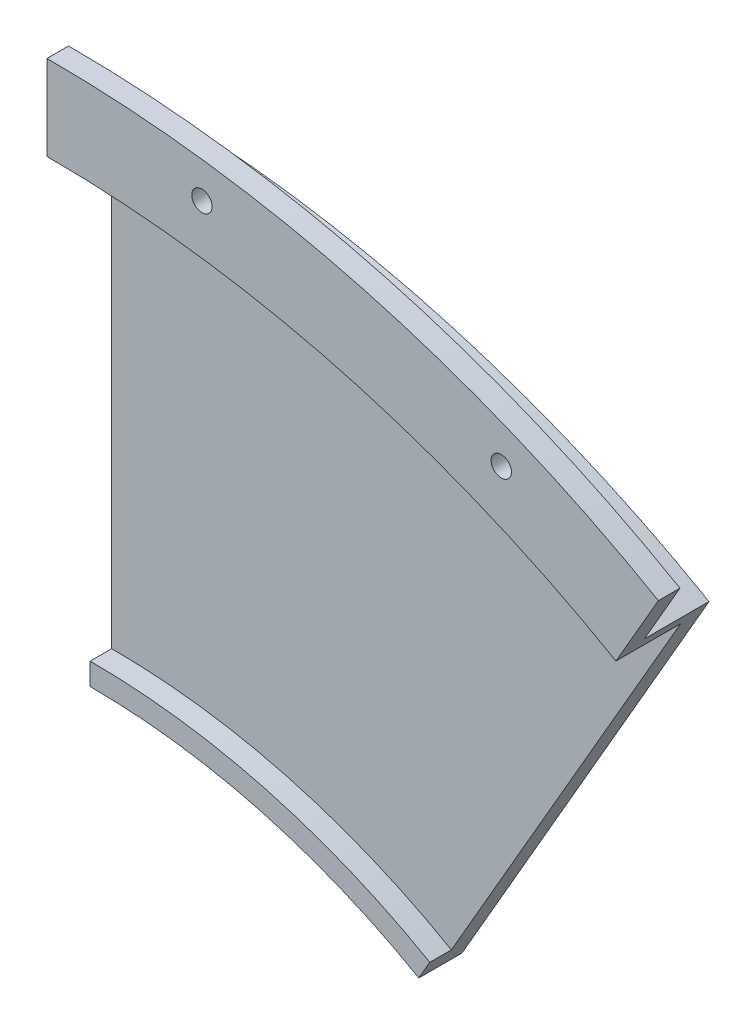
from build123d import *

# Parameters (mm, degrees)
BOSS_EXTRUDE1_DEPTH = 12.7
CUT_EXTRUDE1_DEPTH  = 9.525
CUT_EXTRUDE2_DEPTH  = 6.35
CUT_EXTRUDE3_DEPTH  = 9.525
SKETCH5_R           = 1.5
CUT_EXTRUDE4_DEPTH  = 3.175


with BuildPart() as part:
    # Sketch1 → Boss-Extrude1 (new body)
    with BuildSketch(Plane.XY):
        with BuildLine():
            Line((48.378329117, 83.793724016), (90, 155.884572681))
            ThreePointArc((90, 155.884572681), (46.587428118, 173.866648732), (0, 180))
            Line((0, 180), (0, 96.756658234))
            ThreePointArc((0, 96.756658234), (25.042465891, 93.459755054), (48.378329117, 83.793724016))
        make_face()
    extrude(amount=BOSS_EXTRUDE1_DEPTH)

    # Sketch2 → Cut-Extrude1 (cut)
    with BuildSketch(Plane.XY.offset(12.7)):
        with BuildLine():
            Line((0, 100), (0, 167.5))
            ThreePointArc((0, 167.5), (43.352190055, 161.792575903), (83.75, 145.059255134))
            Line((83.75, 145.059255134), (50, 86.602540378))
            ThreePointArc((50, 86.602540378), (25.88190451, 96.592582629), (0, 100))
        make_face()
    extrude(amount=-CUT_EXTRUDE1_DEPTH, mode=Mode.SUBTRACT)

    # Sketch3 → Cut-Extrude2 (cut)
    with BuildSketch(Plane.XY.offset(12.7)):
        with BuildLine():
            Line((48.378329117, 83.793724016), (50, 86.602540378))
            ThreePointArc((50, 86.602540378), (25.88190451, 96.592582629), (0, 100))
            Line((0, 100), (0, 96.756658234))
            ThreePointArc((0, 96.756658234), (25.042465891, 93.459755054), (48.378329117, 83.793724016))
        make_face()
    extrude(amount=-CUT_EXTRUDE2_DEPTH, mode=Mode.SUBTRACT)

    # Sketch4 → Cut-Extrude3 (cut)
    with BuildSketch(Plane(origin=(0, 0, 0), x_dir=(-1, 0, 0), z_dir=(0, 0, -1))):
        with BuildLine():
            Line((0, 169.5), (0, 180))
            ThreePointArc((0, 180), (-46.587428118, 173.866648732), (-90, 155.884572681))
            Line((-90, 155.884572681), (-84.75, 146.791305941))
            ThreePointArc((-84.75, 146.791305941), (-43.869828145, 163.724427556), (0, 169.5))
        make_face()
    extrude(amount=-CUT_EXTRUDE3_DEPTH, mode=Mode.SUBTRACT)

    # Sketch5 → Cut-Extrude4 (cut)
    with BuildSketch(Plane(origin=(0, 0, 9.525), x_dir=(-1, 0, 0), z_dir=(0, 0, -1))):
        with Locations((-22.80945209, 173.254989525)):
            Circle(SKETCH5_R)
        with Locations(Location((-66.873929806, 161.447948306, 0), (0, 0, 180))):
            Circle(SKETCH5_R)
    extrude(amount=-CUT_EXTRUDE4_DEPTH, mode=Mode.SUBTRACT)


solid = part.part
